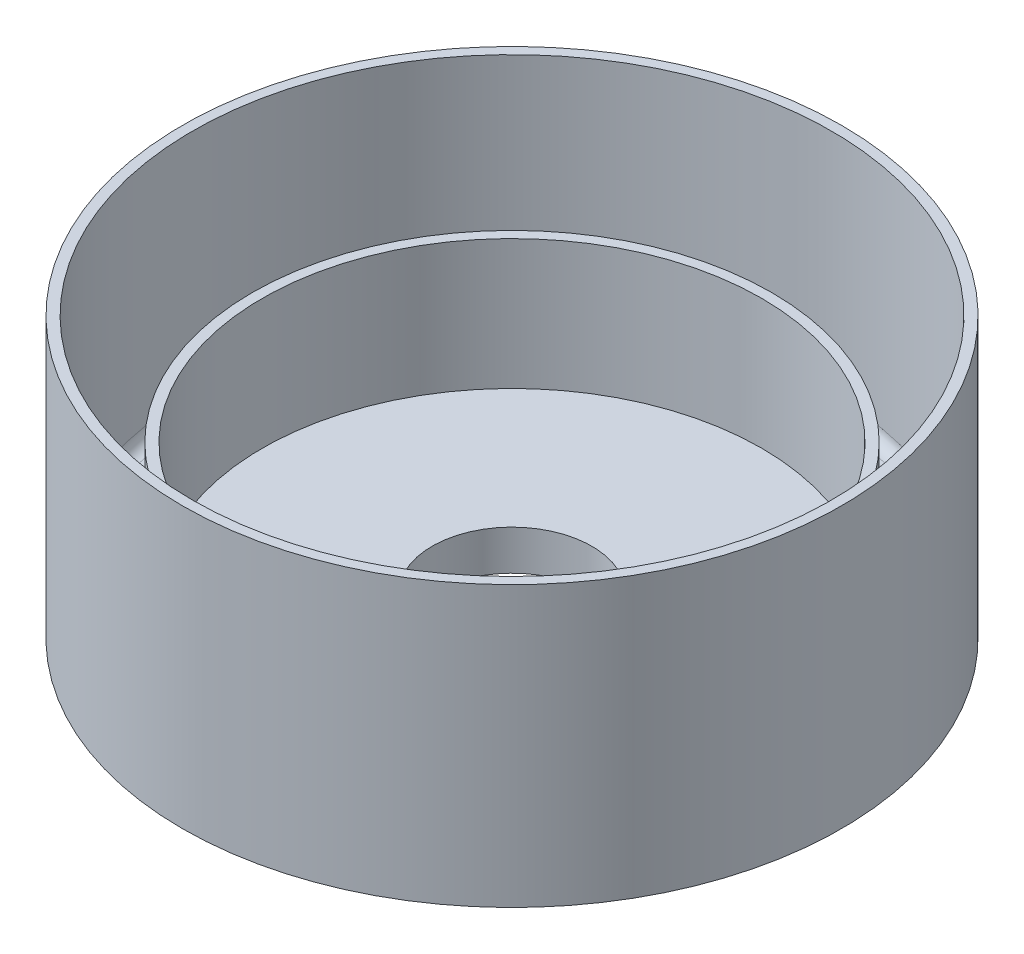
from build123d import *

# Parameters (mm, degrees)
SKETCH11_R          = 82.5
SKETCH11_R_2        = 20
BOSS_EXTRUDE7_DEPTH = 10
SKETCH11_9_R        = 82.5
SKETCH11_9_R_2      = 80
BOSS_EXTRUDE8_DEPTH = 70
SKETCH11_10_R       = 65
SKETCH11_10_R_2     = 62.5
BOSS_EXTRUDE9_DEPTH = 42.5
FILLET2_R           = 3
FILLET3_R           = 3


with BuildPart() as part:
    # Sketch11 → Boss-Extrude7 (new body)
    with BuildSketch(Plane(origin=(0, 0, 0), x_dir=(1, 0, 0), z_dir=(0, 1, 0))):
        Circle(SKETCH11_R)
        Circle(SKETCH11_R_2, mode=Mode.SUBTRACT)
    extrude(amount=BOSS_EXTRUDE7_DEPTH)

    # Sketch11<9> → Boss-Extrude8 (add)
    with BuildSketch(Plane(origin=(0, 0, 0), x_dir=(1, 0, 0), z_dir=(0, 1, 0))):
        Circle(SKETCH11_9_R)
        Circle(SKETCH11_9_R_2, mode=Mode.SUBTRACT)
    extrude(amount=BOSS_EXTRUDE8_DEPTH)

    # Sketch11<10> → Boss-Extrude9 (add)
    with BuildSketch(Plane(origin=(0, 0, 0), x_dir=(1, 0, 0), z_dir=(0, 1, 0))):
        Circle(SKETCH11_10_R)
        Circle(SKETCH11_10_R_2, mode=Mode.SUBTRACT)
    extrude(amount=BOSS_EXTRUDE9_DEPTH)

    # Fillet2
    fillet2_edges = [part.edges().sort_by_distance(p)[0] for p in [
        (-80, 10, 0),
    ]]
    fillet(fillet2_edges, radius=FILLET2_R)

    # Fillet3
    fillet3_edges = [part.edges().sort_by_distance(p)[0] for p in [
        (-65, 10, 0),
    ]]
    fillet(fillet3_edges, radius=FILLET3_R)


solid = part.part
